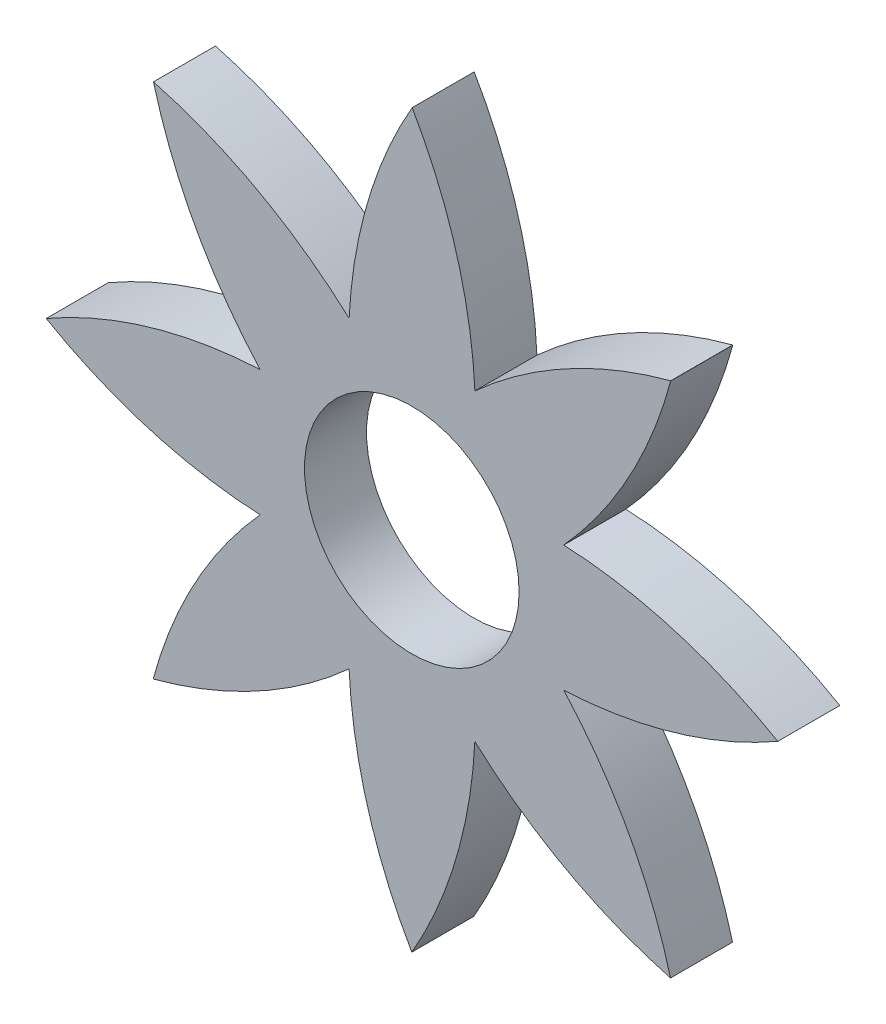
from build123d import *

# Parameters (mm, degrees)
SKETCH1_R           = 10.9855
BOSS_EXTRUDE1_DEPTH = 6.35


with BuildPart() as part:
    # Sketch1 → Boss-Extrude1 (new body)
    with BuildSketch(Plane.XY):
        with BuildLine():
            ThreePointArc((6.459390353, 15.557868916), (4.556224531, 26.894283947), (0.039947491, 37.464978703))
            ThreePointArc((0.039947491, 37.464978703), (-4.49368292, 26.897646704), (-6.413626556, 15.560269287))
            ThreePointArc((-6.413626556, 15.560269287), (-15.775423957, 22.230583772), (-26.443524022, 26.511703594))
            ThreePointArc((-26.443524022, 26.511703594), (-22.177052713, 15.833710673), (-15.517921425, 6.459369056))
            ThreePointArc((-15.517921425, 6.459369056), (-26.854336457, 4.556203234), (-37.425031212, 0.039926193))
            ThreePointArc((-37.425031212, 0.039926193), (-26.857699214, -4.493704217), (-15.520321797, -6.413647853))
            ThreePointArc((-15.520321797, -6.413647853), (-22.190636282, -15.775445254), (-26.471756104, -26.443545319))
            ThreePointArc((-26.471756104, -26.443545319), (-15.793763182, -22.177074011), (-6.419421565, -15.517942722))
            ThreePointArc((-6.419421565, -15.517942722), (-4.516255744, -26.854357754), (2.1297e-05, -37.425052509))
            ThreePointArc((2.1297e-05, -37.425052509), (4.533651708, -26.857720511), (6.453595343, -15.520343094))
            ThreePointArc((6.453595343, -15.520343094), (15.815392745, -22.190657579), (26.48349281, -26.471777401))
            ThreePointArc((26.48349281, -26.471777401), (22.217021501, -15.793784479), (15.557890213, -6.419442862))
            ThreePointArc((15.557890213, -6.419442862), (26.894305245, -4.516277041), (37.465, 0))
            ThreePointArc((37.465, 0), (26.897668002, 4.53363041), (15.560290584, 6.453574046))
            ThreePointArc((15.560290584, 6.453574046), (22.228315638, 15.811184623), (26.509243661, 26.474255901))
            ThreePointArc((26.509243661, 26.474255901), (26.505873515, 26.477630072), (26.502502939, 26.481003814))
            ThreePointArc((26.502502939, 26.481003814), (15.829540649, 22.214716277), (6.459390353, 15.557868916))
        make_face()
        Circle(SKETCH1_R, mode=Mode.SUBTRACT)
    extrude(amount=BOSS_EXTRUDE1_DEPTH)


solid = part.part
